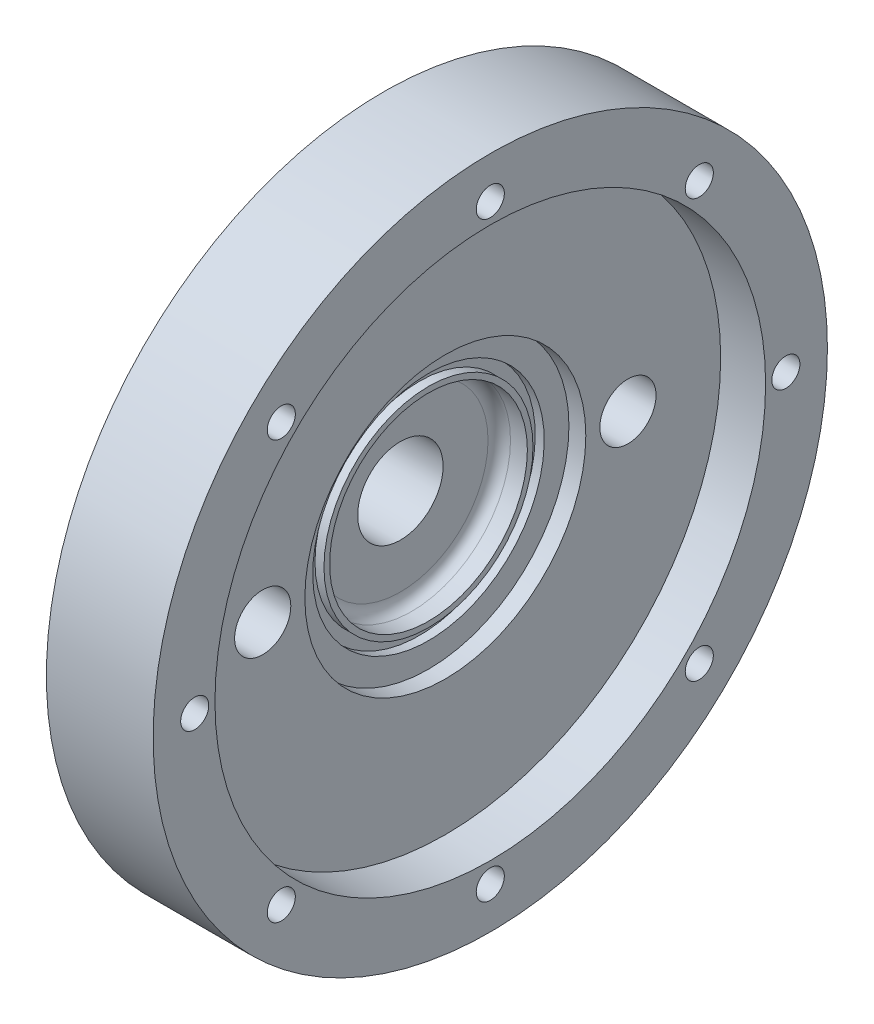
from build123d import *

# Parameters (mm, degrees)
SKETCH4_W               = 2.032
SKETCH4_H               = 2.54
SKETCH5_R               = 76.2
SKETCH5_R_2             = 31.75
BOSS_EXTRUDE1_DEPTH     = 3.81
SKETCH6_R               = 76.2
SKETCH6_R_2             = 62.23
BOSS_EXTRUDE2_DEPTH     = 10.16
CUT_EXTRUDE1_DEPTH      = 113.342968182
CUT_EXTRUDE1_DEPTH_BACK = 113.342968182
SKETCH2_R               = 6.35
SKETCH3_R               = 3.175
CUT_EXTRUDE2_DEPTH      = 113.342968182
CIRPATTERN1_COUNT       = 8


with BuildPart() as part:
    # Sketch1 → Revolve1 (revolve)
    with BuildSketch(Plane.XY, mode=Mode.PRIVATE) as revolve1_sk:
        with BuildLine():
            Line((0, 76.2), (-10.16, 76.2))
            Line((-10.16, 76.2), (-10.16, 21.082))
            ThreePointArc((-10.16, 21.082), (-11.647897552, 17.489897552), (-15.24, 16.002))
            Line((-15.24, 16.002), (-31.75, 16.002))
            Line((-31.75, 16.002), (-31.75, 9.652))
            Line((-31.75, 9.652), (-6.35, 9.652))
            Line((-6.35, 9.652), (-6.35, 19.812))
            ThreePointArc((-6.35, 19.812), (-5.606051224, 21.608051224), (-3.81, 22.352))
            Line((-3.81, 22.352), (0, 22.352))
            Line((0, 22.352), (0, 76.2))
        make_face()
    revolve(revolve1_sk.sketch.rotate(Axis((0, 0, 0), (-1, 0, 0)), 90), axis=Axis((0, 0, 0), (-1, 0, 0)))

    # Sketch4 → Cut-Revolve1 (revolve, cut)
    with BuildSketch(Plane.XY):
        with Locations((-1.016, 24.892)):
            Rectangle(SKETCH4_W, SKETCH4_H)
    revolve(axis=Axis((0, 0, 0), (-1, 0, 0)), mode=Mode.SUBTRACT)

    # Sketch5 → Boss-Extrude1 (add)
    with BuildSketch(Plane(origin=(0, 0, 0), x_dir=(0, 0, -1), z_dir=(1, 0, 0))):
        Circle(SKETCH5_R)
        with Locations(Location((0, 0, 0), (0, 0, 180))):
            Circle(SKETCH5_R_2, mode=Mode.SUBTRACT)
    extrude(amount=BOSS_EXTRUDE1_DEPTH)

    # Sketch6 → Boss-Extrude2 (add)
    with BuildSketch(Plane(origin=(3.81, 0, 0), x_dir=(0, 0, -1), z_dir=(1, 0, 0))):
        Circle(SKETCH6_R)
        Circle(SKETCH6_R_2, mode=Mode.SUBTRACT)
    extrude(amount=BOSS_EXTRUDE2_DEPTH)

    # Sketch2 → Cut-Extrude1 (cut, two sides: drawn at the far end of the back side and taken through both)
    with BuildSketch(Plane(origin=(0, 0, 0), x_dir=(0, 0, -1), z_dir=(1, 0, 0)).offset(-CUT_EXTRUDE1_DEPTH_BACK)):
        with Locations((41.275, 0)):
            Circle(SKETCH2_R)
        with Locations((-41.275, 0)):
            Circle(SKETCH2_R)
    extrude(amount=CUT_EXTRUDE1_DEPTH + CUT_EXTRUDE1_DEPTH_BACK, mode=Mode.SUBTRACT)

    # Sketch3 → Cut-Extrude2 (cut, symmetric)
    with BuildSketch(Plane(origin=(0, 0, 0), x_dir=(0, 0, -1), z_dir=(1, 0, 0))):
        with Locations((66.802, 0)):
            Circle(SKETCH3_R)
    cut_extrude2 = extrude(amount=CUT_EXTRUDE2_DEPTH, both=True, mode=Mode.SUBTRACT)

    # CirPattern1: Cut-Extrude2 ×8 about axis
    cirpattern1_axis = Axis((0, 0, 0), (1, 0, 0))
    for i in range(1, CIRPATTERN1_COUNT):
        add(cut_extrude2.rotate(cirpattern1_axis, i * 360 / CIRPATTERN1_COUNT), mode=Mode.SUBTRACT)


solid = part.part
